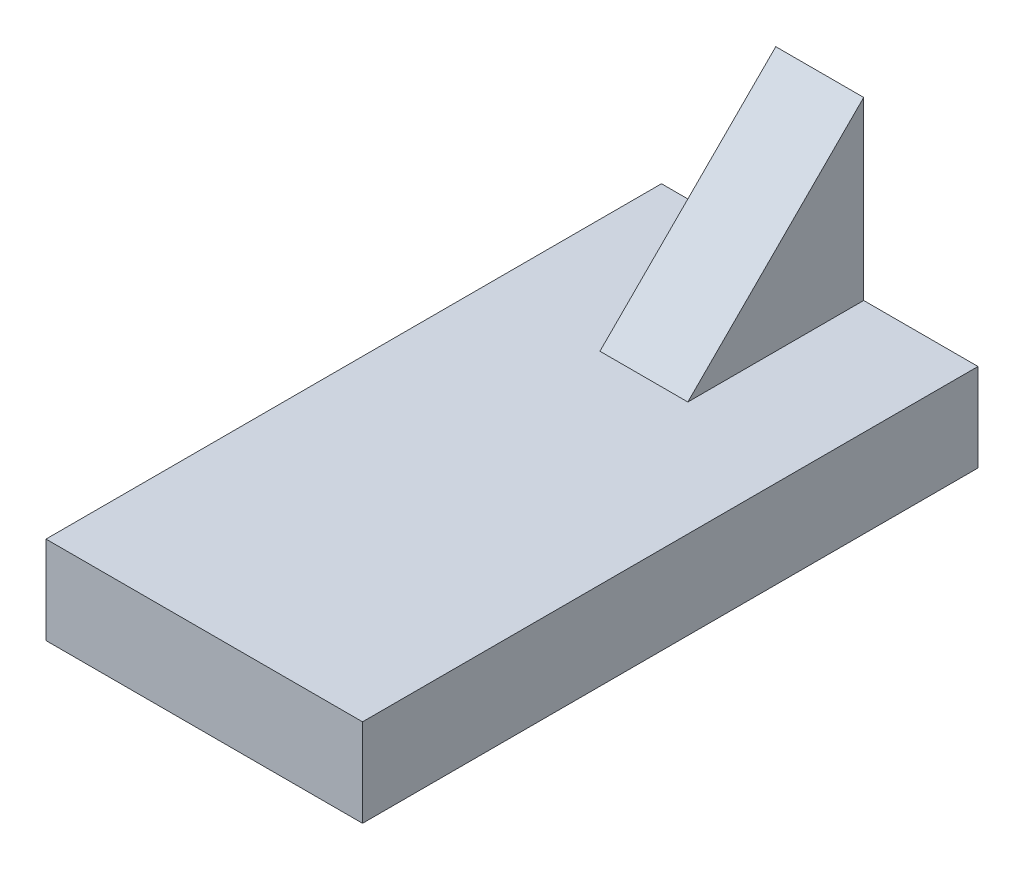
from build123d import *

# Parameters (mm, degrees)
SKETCH_1_W           = 36
SKETCH_1_H           = 10
EXTRUDE_1_DEPTH      = 70
EXTRUDE_2_DEPTH      = 5
EXTRUDE_2_DEPTH_BACK = 5


with BuildPart() as part:
    # 草图1 → 凸台-拉伸1 (new body)
    with BuildSketch(Plane(origin=(0, 0, 1023.154259328), x_dir=(-1, 0, 0), z_dir=(0, 0, -1))):
        with Locations((86.606649797, -103.783530386)):
            Rectangle(SKETCH_1_W, SKETCH_1_H)
    extrude(amount=EXTRUDE_1_DEPTH)

    # 草图3 → 凸台-拉伸2 (add, two sides: drawn at the far end of the back side and taken through both)
    with BuildSketch(Plane.ZY.offset(86.606649797).offset(-EXTRUDE_2_DEPTH_BACK)):
        Polygon((953.154259328, -98.783530386), (953.154259328, -78.783530386), (973.154259328, -98.783530386), align=None)
    extrude(amount=EXTRUDE_2_DEPTH + EXTRUDE_2_DEPTH_BACK)


solid = part.part
